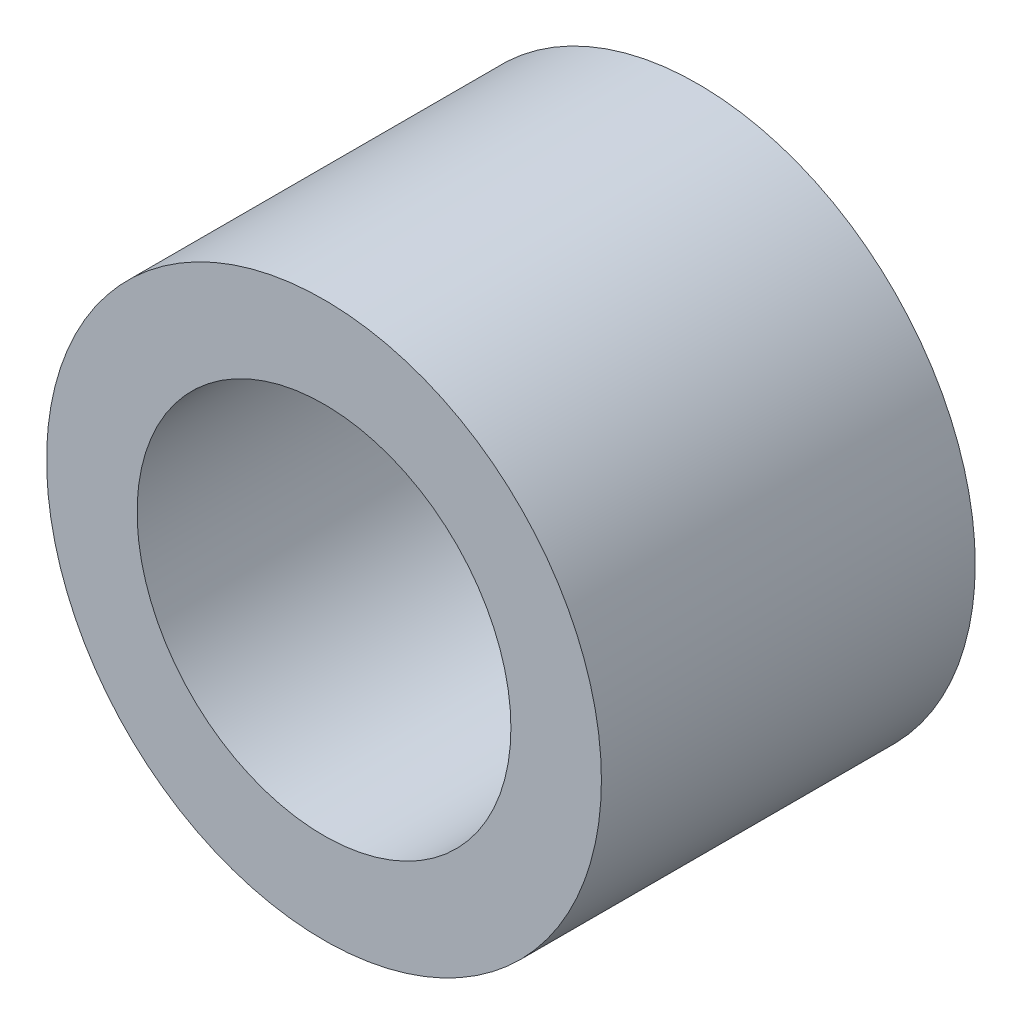
from build123d import *

# Parameters (mm, degrees)
SKETCH1_R      = 9.424514051
SKETCH1_R_2    = 6.35
EXTRUDE1_DEPTH = 12.7


with BuildPart() as part:
    # Sketch1 → Extrude1 (new body)
    with BuildSketch(Plane.XY):
        Circle(SKETCH1_R)
        Circle(SKETCH1_R_2, mode=Mode.SUBTRACT)
    extrude(amount=-EXTRUDE1_DEPTH)


solid = part.part
